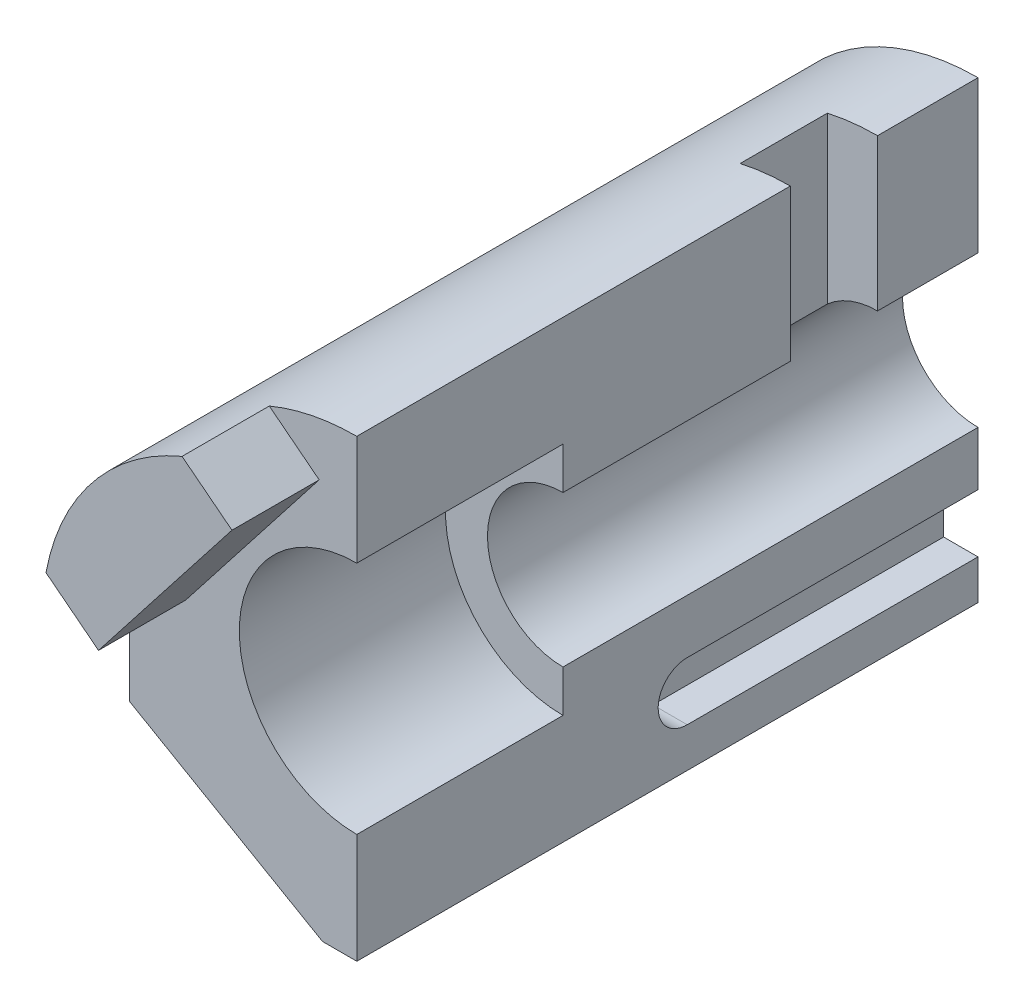
from build123d import *

# Parameters (mm, degrees)
BOSS_EXTRU_1_DEPTH      = 235
ESQUISSE2_R             = 44.45
ENL_V_MAT_EXTRU_1_DEPTH = 78
ESQUISSE3_R             = 28.575
ENL_V_MAT_EXTRU_2_DEPTH = 199.597583067
BOSS_EXTRU_4_DEPTH      = 33
ESQUISSE8_W             = 33
ESQUISSE8_H             = 90
ENL_V_MAT_EXTRU_4_DEPTH = 19
ENL_V_MAT_EXTRU_5_DEPTH = 13


with BuildPart() as part:
    # Esquisse1 → Boss.-Extru.1 (new body)
    with BuildSketch(Plane.XY):
        with BuildLine():
            Line((0, -86), (0, 86))
            ThreePointArc((0, 86), (-60.811183182, 60.811183182), (-86, 0))
            Line((-86, 0), (-86, -43.853430349))
            Line((-86, -43.853430349), (-13, -86))
            Line((-13, -86), (0, -86))
        make_face()
    extrude(amount=BOSS_EXTRU_1_DEPTH)

    # Esquisse2 → Enlèv. mat.-Extru.1 (cut)
    with BuildSketch(Plane.XY.offset(235)):
        Circle(ESQUISSE2_R)
    extrude(amount=-ENL_V_MAT_EXTRU_1_DEPTH, mode=Mode.SUBTRACT)

    # Esquisse3 → Enlèv. mat.-Extru.2 (cut, through all)
    with BuildSketch(Plane.XY.offset(157)):
        Circle(ESQUISSE3_R)
    extrude(amount=-ENL_V_MAT_EXTRU_2_DEPTH, mode=Mode.SUBTRACT)

    # Esquisse7 → Boss.-Extru.4 (add)
    with BuildSketch(Plane.XY.offset(235)):
        with BuildLine():
            Line((-64.719928969, 0), (-40.188548434, 31.398735242))
            Line((-40.188548434, 31.398735242), (-14.235687992, 64.616881796))
            Line((-14.235687992, 64.616881796), (-33.116437077, 79.368139674))
            ThreePointArc((-33.116437077, 79.368139674), (-66.952455175, 53.975631039), (-84.587575845, 15.522306937))
            Line((-84.587575845, 15.522306937), (-64.719928969, 0))
        make_face()
    extrude(amount=BOSS_EXTRU_4_DEPTH)

    # Esquisse8 → Enlèv. mat.-Extru.4 (cut)
    with BuildSketch(Plane(origin=(0, 0, 0), x_dir=(0, 0, -1), z_dir=(1, 0, 0))):
        with Locations((-54.5, 49.335999727)):
            Rectangle(ESQUISSE8_W, ESQUISSE8_H)
    extrude(amount=-ENL_V_MAT_EXTRU_4_DEPTH, mode=Mode.SUBTRACT)

    # Esquisse9 → Enlèv. mat.-Extru.5 (cut)
    with BuildSketch(Plane(origin=(0, 0, 0), x_dir=(0, 0, -1), z_dir=(1, 0, 0))):
        with BuildLine():
            Line((-110, -49), (0, -49))
            Line((0, -49), (0, -71))
            Line((0, -71), (-110, -71))
            ThreePointArc((-110, -71), (-121, -60), (-110, -49))
        make_face()
    extrude(amount=-ENL_V_MAT_EXTRU_5_DEPTH, mode=Mode.SUBTRACT)


solid = part.part
